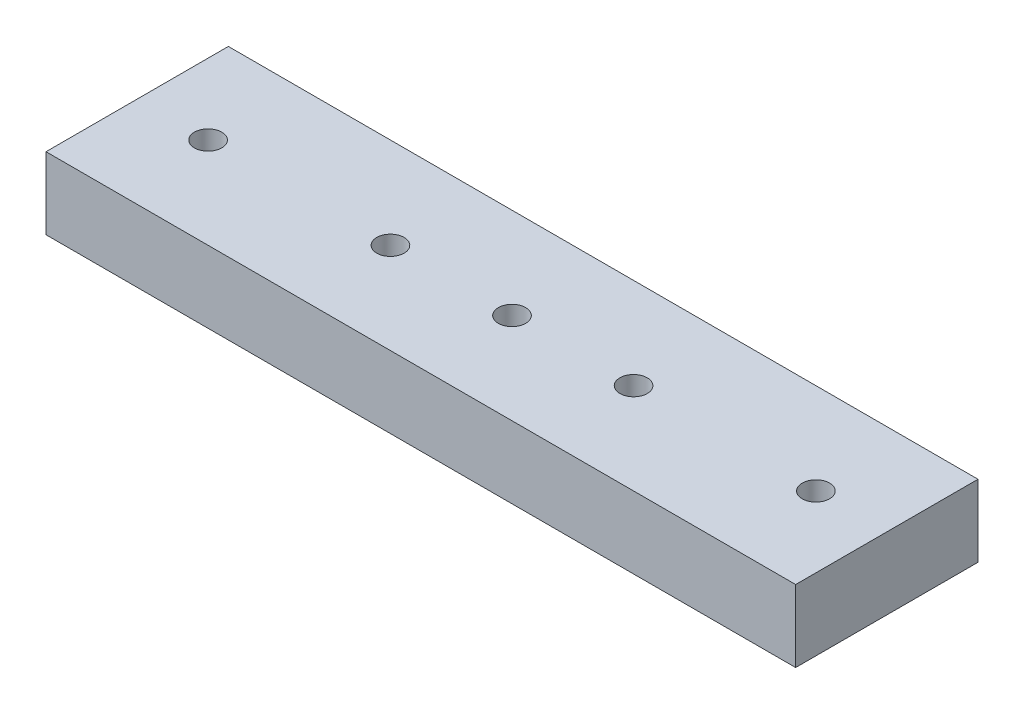
from build123d import *

# Parameters (mm, degrees)
SKETCH_3_W                    = 370
SKETCH_3_H                    = 90
EXTRUDE_2_DEPTH               = 35.5
HOLE_WIZARD_M12_1_D           = 13.5
HOLE_WIZARD_M12_1_CBORE_D     = 20
HOLE_WIZARD_M12_1_CBORE_DEPTH = 13
CUT_EXTRUDE_1_DEPTH           = 13
HOLE_WIZARD_M12_2_D           = 13.5
HOLE_WIZARD_M12_2_CBORE_D     = 20
HOLE_WIZARD_M12_2_CBORE_DEPTH = 13


with BuildPart() as part:
    # 草图3 → 凸台-拉伸2 (new body)
    with BuildSketch(Plane(origin=(0, 0, 0), x_dir=(1, 0, 0), z_dir=(0, 1, 0))):
        Rectangle(SKETCH_3_W, SKETCH_3_H)
    extrude(amount=EXTRUDE_2_DEPTH)

    # M12 六角头螺栓的柱形沉头孔1 (through all)
    with Locations(Plane(origin=(0, 0, 0), x_dir=(-1, 0, 0), z_dir=(0, -1, 0))):
        with Locations((-150, 0), (-60, 0), (60, 0), (150, 0)):
            CounterBoreHole(HOLE_WIZARD_M12_1_D / 2, HOLE_WIZARD_M12_1_CBORE_D / 2, HOLE_WIZARD_M12_1_CBORE_DEPTH)

    # 草图7 → 切除-拉伸1 (cut)
    with BuildSketch(Plane.XZ):
        with BuildLine():
            Line((-12.5, -22.5), (-12.5, 22.5))
            ThreePointArc((-12.5, 22.5), (0, 35), (12.5, 22.5))
            Line((12.5, 22.5), (12.5, -22.5))
            ThreePointArc((12.5, -22.5), (0, -35), (-12.5, -22.5))
        make_face()
    extrude(amount=-CUT_EXTRUDE_1_DEPTH, mode=Mode.SUBTRACT)

    # M12 六角头螺栓的柱形沉头孔2 (through all)
    with Locations(Plane(origin=(0, 13, 0), x_dir=(-1, 0, 0), z_dir=(0, -1, 0))):
        with Locations((0, 0)):
            CounterBoreHole(HOLE_WIZARD_M12_2_D / 2, HOLE_WIZARD_M12_2_CBORE_D / 2, HOLE_WIZARD_M12_2_CBORE_DEPTH)


solid = part.part
